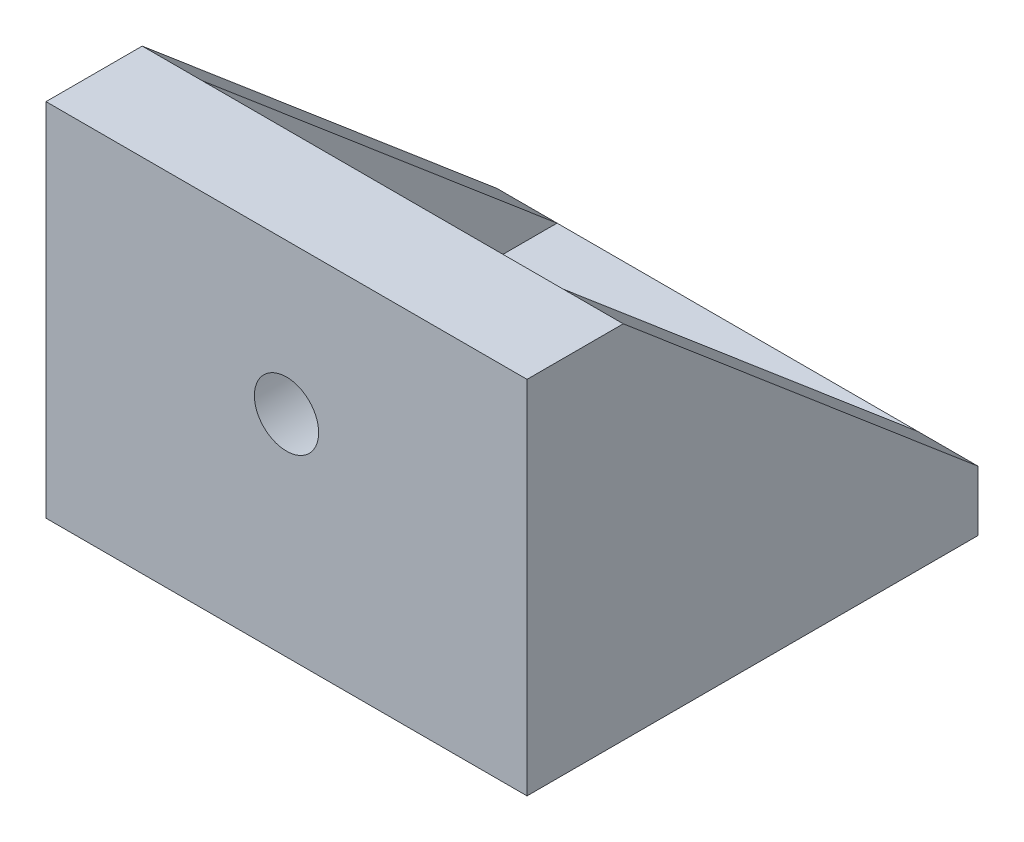
from build123d import *

# Parameters (mm, degrees)
SKETCH1_W                                       = 40
SKETCH1_H                                       = 37.5
BOSS_EXTRUDE1_DEPTH                             = 5
SKETCH2_W                                       = 40
SKETCH2_H                                       = 30
BOSS_EXTRUDE2_DEPTH                             = 8
BOSS_EXTRUDE3_DEPTH                             = 5
BOSS_EXTRUDE4_START                             = -40
BOSS_EXTRUDE4_DEPTH                             = 5
CSK_FOR_M3_FLAT_HEAD_MACHINE_SCREW1_D           = 3.4
CSK_FOR_M3_FLAT_HEAD_MACHINE_SCREW1_DEPTH       = 6
CSK_FOR_M3_FLAT_HEAD_MACHINE_SCREW1_CSINK_D     = 6.3
CSK_FOR_M3_FLAT_HEAD_MACHINE_SCREW1_CSINK_ANGLE = 90
CSK_FOR_M3_FLAT_HEAD_MACHINE_SCREW1_TIP         = 1.021463052
F_12_0_12_DIAMETER_HOLE1_D                      = 12
F_12_0_12_DIAMETER_HOLE1_DEPTH                  = 6
F_12_0_12_DIAMETER_HOLE1_TIP                    = 3.605163714


with BuildPart() as part:
    # Sketch1 → Boss-Extrude1 (new body)
    with BuildSketch(Plane(origin=(0, 0, 0), x_dir=(1, 0, 0), z_dir=(0, 1, 0))):
        Rectangle(SKETCH1_W, SKETCH1_H)
    extrude(amount=BOSS_EXTRUDE1_DEPTH)

    # Sketch2 → Boss-Extrude2 (add)
    with BuildSketch(Plane.XY.offset(18.75)):
        with Locations((0, 15)):
            Rectangle(SKETCH2_W, SKETCH2_H)
    extrude(amount=-BOSS_EXTRUDE2_DEPTH)

    # Sketch3 → Boss-Extrude3 (add)
    with BuildSketch(Plane(origin=(20, 0, 0), x_dir=(0, 0, -1), z_dir=(1, 0, 0))):
        Polygon((-10.75, 30), (18.75, 5), (-10.75, 5), align=None)
    extrude(amount=-BOSS_EXTRUDE3_DEPTH)

    # Sketch3<2> → Boss-Extrude4 (add)
    with BuildSketch(Plane(origin=(20, 0, 0), x_dir=(0, 0, -1), z_dir=(1, 0, 0)).offset(BOSS_EXTRUDE4_START)):
        Polygon((-10.75, 30), (18.75, 5), (-10.75, 5), align=None)
    extrude(amount=BOSS_EXTRUDE4_DEPTH)

    # CSK for M3 Flat Head Machine Screw1
    with Locations(Plane(origin=(0, 5, 0), x_dir=(1, 0, 0), z_dir=(0, 1, 0))):
        with Locations((8.660254038, -3.5), (0, 11.5), (-8.660254038, -3.5)):
            CounterSinkHole(CSK_FOR_M3_FLAT_HEAD_MACHINE_SCREW1_D / 2, CSK_FOR_M3_FLAT_HEAD_MACHINE_SCREW1_CSINK_D / 2, depth=CSK_FOR_M3_FLAT_HEAD_MACHINE_SCREW1_DEPTH, counter_sink_angle=CSK_FOR_M3_FLAT_HEAD_MACHINE_SCREW1_CSINK_ANGLE)
            with Locations((0, 0, -(CSK_FOR_M3_FLAT_HEAD_MACHINE_SCREW1_DEPTH + CSK_FOR_M3_FLAT_HEAD_MACHINE_SCREW1_TIP / 2))):  # 118° drill point
                Cone(0, CSK_FOR_M3_FLAT_HEAD_MACHINE_SCREW1_D / 2, CSK_FOR_M3_FLAT_HEAD_MACHINE_SCREW1_TIP, mode=Mode.SUBTRACT)

    # Ø12.0 (12) Diameter Hole1
    with Locations(Plane(origin=(0, 0, 10.75), x_dir=(-1, 0, 0), z_dir=(0, 0, -1))):
        with Locations((0, 17.5)):
            Hole(F_12_0_12_DIAMETER_HOLE1_D / 2, depth=F_12_0_12_DIAMETER_HOLE1_DEPTH)
            with Locations((0, 0, -(F_12_0_12_DIAMETER_HOLE1_DEPTH + F_12_0_12_DIAMETER_HOLE1_TIP / 2))):  # 118° drill point
                Cone(0, F_12_0_12_DIAMETER_HOLE1_D / 2, F_12_0_12_DIAMETER_HOLE1_TIP, mode=Mode.SUBTRACT)


solid = part.part
